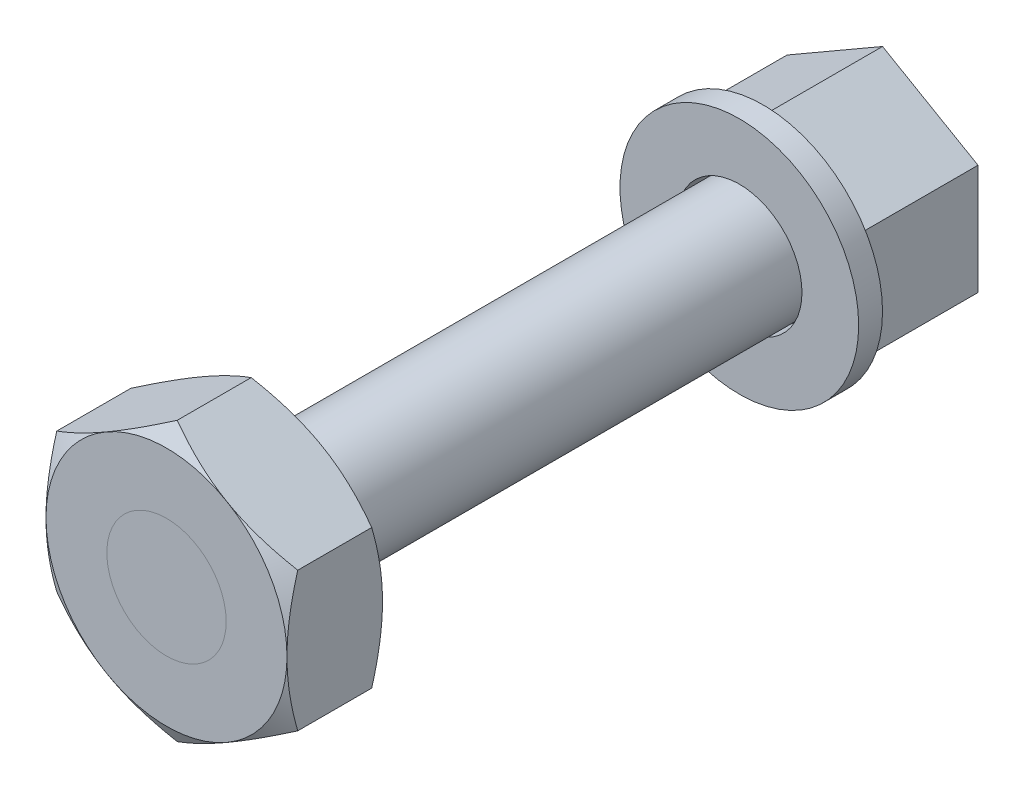
from build123d import *

# Parameters (mm, degrees)
SKETCH1_R           = 5
BOSS_EXTRUDE1_DEPTH = 10
BOSS_EXTRUDE2_START = 10
SKETCH1_3_R         = 5
BOSS_EXTRUDE2_DEPTH = 50
BOSS_EXTRUDE3_START = 10
SKETCH3_R           = 10
SKETCH3_R_2         = 5.25
BOSS_EXTRUDE3_DEPTH = 2
SKETCH4_R           = 5
BOSS_EXTRUDE4_DEPTH = 8


with BuildPart() as part:
    # Sketch1 → Boss-Extrude1 (new body)
    # profile 1 of 2: a face of its own
    with BuildSketch(Plane.XY):
        Polygon((-11.163210479, -1.701501358), (-3.163210479, 2.917300796), (-3.163210479, 12.154905103), (-11.163210479, 16.773707256), (-19.163210479, 12.154905103), (-19.163210479, 2.917300796), align=None)
        with Locations((-11.163210479, 7.536102949)):
            Circle(SKETCH1_R, mode=Mode.SUBTRACT)
    # profile 2 of 2: a face of its own
    with BuildSketch(Plane.XY):
        with Locations((-11.163210479, 7.536102949)):
            Circle(SKETCH1_R)
    extrude(amount=BOSS_EXTRUDE1_DEPTH)

    # Sketch1<3> → Boss-Extrude2 (add)
    with BuildSketch(Plane.XY.offset(BOSS_EXTRUDE2_START)):
        with Locations((-11.163210479, 7.536102949)):
            Circle(SKETCH1_3_R)
    extrude(amount=BOSS_EXTRUDE2_DEPTH)


with BuildPart() as body_2:
    # Sketch3 → Boss-Extrude3 (new body)
    with BuildSketch(Plane.XY.offset(BOSS_EXTRUDE3_START)):
        with Locations((-11.163210479, 7.536102949)):
            Circle(SKETCH3_R)
        with Locations((-11.163210479, 7.536102949)):
            Circle(SKETCH3_R_2, mode=Mode.SUBTRACT)
    extrude(amount=BOSS_EXTRUDE3_DEPTH)


with BuildPart() as body_3:
    # Sketch4 → Boss-Extrude4 (new body)
    with BuildSketch(Plane.XY.offset(60)):
        Polygon((-11.163210479, -4.123618998), (-1.065595071, 1.706241975), (-1.065595071, 13.365963923), (-11.163210479, 19.195824897), (-21.260825886, 13.365963923), (-21.260825886, 1.706241975), align=None)
        with Locations((-11.163210479, 7.536102949)):
            Circle(SKETCH4_R, mode=Mode.SUBTRACT)
    extrude(amount=-BOSS_EXTRUDE4_DEPTH)

    # Sketch5 → Cut-Revolve1 (revolve, cut)
    with BuildSketch(Plane(origin=(0, 7.536102949, 0), x_dir=(-1, 0, 0), z_dir=(0, -1, 0))):
        Polygon((28.189029116, -56), (14.332622656, -64), (14.332622656, -68.5), (39.332622656, -68.5), (39.332622656, -43.5), (14.332622656, -43.5), (14.332622656, -48), align=None)
    revolve(axis=Axis((-11.163210479, 7.536102949, 91.6), (0, 0, 1)), mode=Mode.SUBTRACT)


solid = Compound([part.part, body_2.part, body_3.part])
